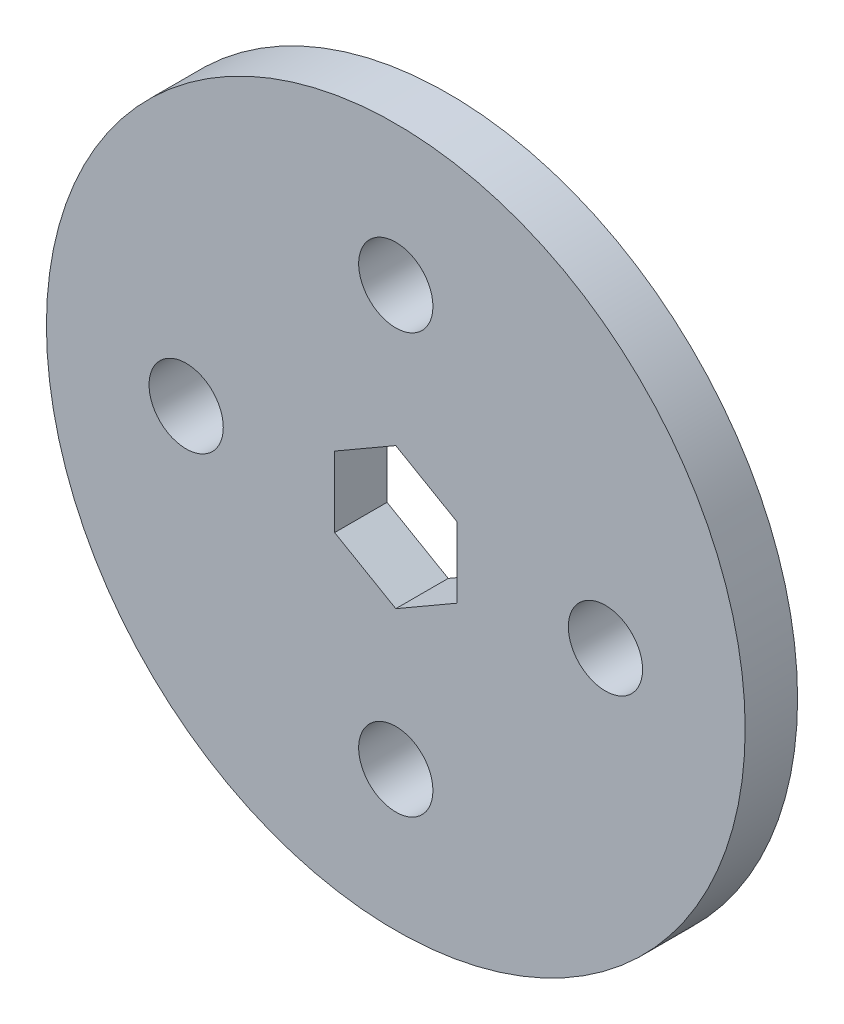
from build123d import *

# Parameters (mm, degrees)
SKETCH1_R           = 20
BOSS_EXTRUDE1_DEPTH = 3
CUT_EXTRUDE2_DEPTH  = 3
SKETCH4_R           = 2.125
CUT_EXTRUDE3_DEPTH  = 10


with BuildPart() as part:
    # Sketch1 → Boss-Extrude1 (new body)
    with BuildSketch(Plane.XY):
        Circle(SKETCH1_R)
    extrude(amount=BOSS_EXTRUDE1_DEPTH)

    # Sketch3 → Cut-Extrude2 (cut)
    with BuildSketch(Plane.XY.offset(3)):
        Polygon((0, 4.041451884), (-3.5, 2.020725942), (-3.5, -2.020725942), (0, -4.041451884), (3.5, -2.020725942), (3.5, 2.020725942), align=None)
    extrude(amount=-CUT_EXTRUDE2_DEPTH, mode=Mode.SUBTRACT)

    # Sketch4 → Cut-Extrude3 (cut)
    with BuildSketch(Plane.XY.offset(3)):
        with Locations((0, 12)):
            Circle(SKETCH4_R)
        with Locations((12, 0)):
            Circle(SKETCH4_R)
        with Locations((0, -12)):
            Circle(SKETCH4_R)
        with Locations((-12, 0)):
            Circle(SKETCH4_R)
    extrude(amount=-CUT_EXTRUDE3_DEPTH, mode=Mode.SUBTRACT)


solid = part.part
